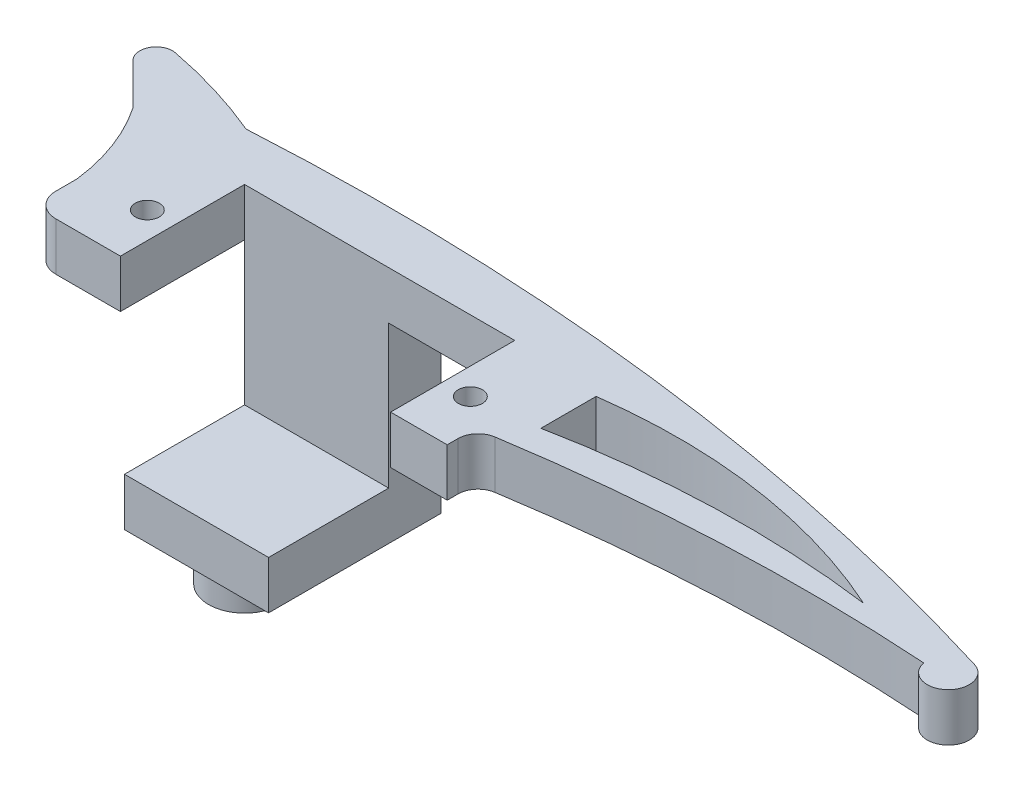
from build123d import *

# Parameters (mm, degrees)
SKETCH1_R           = 1
BOSS_EXTRUDE1_DEPTH = 2
BOSS_EXTRUDE2_START = -4
BOSS_EXTRUDE2_DEPTH = 15.9
SKETCH3_W           = 12
SKETCH3_H           = 4
BOSS_EXTRUDE3_DEPTH = 10
SKETCH5_R           = 3
BOSS_EXTRUDE4_DEPTH = 3


with BuildPart() as part:
    # Sketch1 → Boss-Extrude1 (new, symmetric)
    with BuildSketch(Plane(origin=(0, 0, 0), x_dir=(1, 0, 0), z_dir=(0, 1, 0))):
        with BuildLine():
            Line((14, 0), (14, 5.9))
            Line((14, 5.9), (36.5, 5.9))
            Line((36.5, 5.9), (36.5, 0))
            Line((36.5, 0), (36.5, -4.438518159))
            Line((36.5, -4.438518159), (41.213519663, -4.438518159))
            Line((41.213519663, -4.438518159), (41.213519663, -3.536214297))
            ThreePointArc((41.213519663, -3.536214297), (41.613535265, -2.452170394), (42.621822841, -1.887794784))
            ThreePointArc((42.621822841, -1.887794784), (59.657919167, -0.157445784), (76.780825793, -0.327016892))
            ThreePointArc((76.780825793, -0.327016892), (79.667666349, -1.303478154), (79.013446705, 1.672983108))
            ThreePointArc((79.013446705, 1.672983108), (44.912555428, 8.893863941), (10.071688353, 9.954942307))
            ThreePointArc((10.071688353, 9.954942307), (5.913323938, 11.457100516), (1.620293164, 12.514626243))
            ThreePointArc((1.620293164, 12.514626243), (0.158700912, 11.813412309), (0.399525234, 10.21030391))
            Line((0.399525234, 10.21030391), (3.821916897, 6.787912247))
            ThreePointArc((3.821916897, 6.787912247), (5.672488258, 3.21348854), (6.62634024, -0.696918803))
            Line((6.62634024, -0.696918803), (6.62634024, -2.438518159))
            ThreePointArc((6.62634024, -2.438518159), (7.212126678, -3.852731721), (8.62634024, -4.438518159))
            Line((8.62634024, -4.438518159), (14, -4.438518159))
            Line((14, -4.438518159), (14, 0))
        make_face()
        with Locations(Location((11.8, 0, 0), (0, 0, 270))):
            Circle(SKETCH1_R, mode=Mode.SUBTRACT)
        with Locations(Location((38.7, 0, 0), (0, 0, 270))):
            Circle(SKETCH1_R, mode=Mode.SUBTRACT)
        with BuildLine():
            Line((43.924254337, 5.25), (43.924254337, 0.65))
            ThreePointArc((43.924254337, 0.65), (56.919306874, 2.126797691), (69.981420933, 1.468391921))
            ThreePointArc((69.981420933, 1.468391921), (57.21989374, 5.199345781), (43.924254337, 5.25))
        make_face(mode=Mode.SUBTRACT)
    extrude(amount=BOSS_EXTRUDE1_DEPTH, both=True)

    # Sketch2 → Boss-Extrude2 (add)
    with BuildSketch(Plane(origin=(0, 2, 0), x_dir=(1, 0, 0), z_dir=(0, 1, 0)).offset(BOSS_EXTRUDE2_START)):
        with BuildLine():
            Line((14, 5.9), (14, 10.146104419))
            ThreePointArc((14, 10.146104419), (19.999270016, 10.285681215), (26, 10.241385974))
            Line((26, 10.241385974), (26, 5.9))
            Line((26, 5.9), (14, 5.9))
        make_face()
    extrude(amount=-BOSS_EXTRUDE2_DEPTH)

    # Sketch3 → Boss-Extrude3 (add)
    with BuildSketch(Plane.XY.offset(-5.9)):
        with Locations((20, -15.9)):
            Rectangle(SKETCH3_W, SKETCH3_H)
    extrude(amount=BOSS_EXTRUDE3_DEPTH)

    # Sketch5 → Boss-Extrude4 (add)
    with BuildSketch(Plane(origin=(0, -17.9, 0), x_dir=(-1, 0, 0), z_dir=(0, -1, 0))):
        with Locations(Location((-19.9, 0, 0), (0, 0, 90))):
            Circle(SKETCH5_R)
    extrude(amount=BOSS_EXTRUDE4_DEPTH)


solid = part.part
